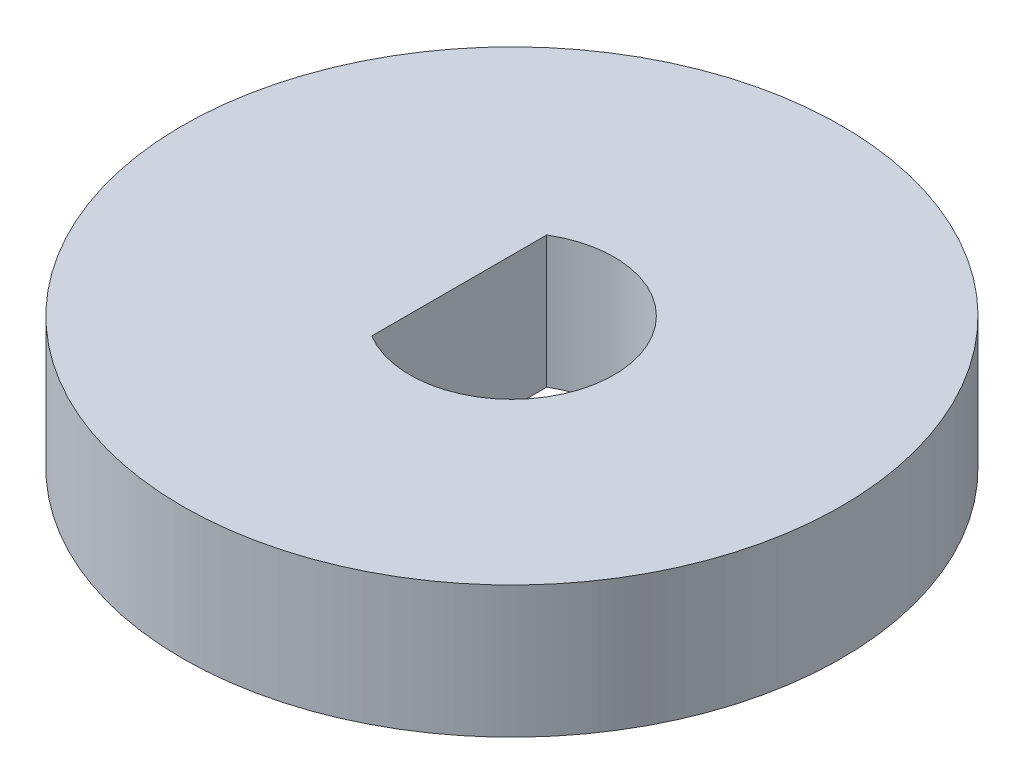
from build123d import *

# Parameters (mm, degrees)
BOSS_EXTRU_1_START = 17.4
ESQUISSE1_R        = 10
BOSS_EXTRU_1_DEPTH = 4


with BuildPart() as part:
    # Esquisse1 → Boss.-Extru.1 (new body)
    with BuildSketch(Plane(origin=(0, 0, 0), x_dir=(1, 0, 0), z_dir=(0, 1, 0)).offset(BOSS_EXTRU_1_START)):
        with Locations(Location((0, 0, 0), (0, 0, 270))):
            Circle(ESQUISSE1_R)
        with BuildLine():
            Line((-1.6, -2.244994432), (-1.6, -2.655183609))
            ThreePointArc((-1.6, -2.655183609), (-0.830340536, -2.986726401), (0, -3.1))
            ThreePointArc((0, -3.1), (3.1, 0), (0, 3.1))
            ThreePointArc((0, 3.1), (-0.830340536, 2.986726401), (-1.6, 2.655183609))
            Line((-1.6, 2.655183609), (-1.6, 2.244994432))
            Line((-1.6, 2.244994432), (-1.6, -2.244994432))
        make_face(mode=Mode.SUBTRACT)
    extrude(amount=BOSS_EXTRU_1_DEPTH)


solid = part.part
